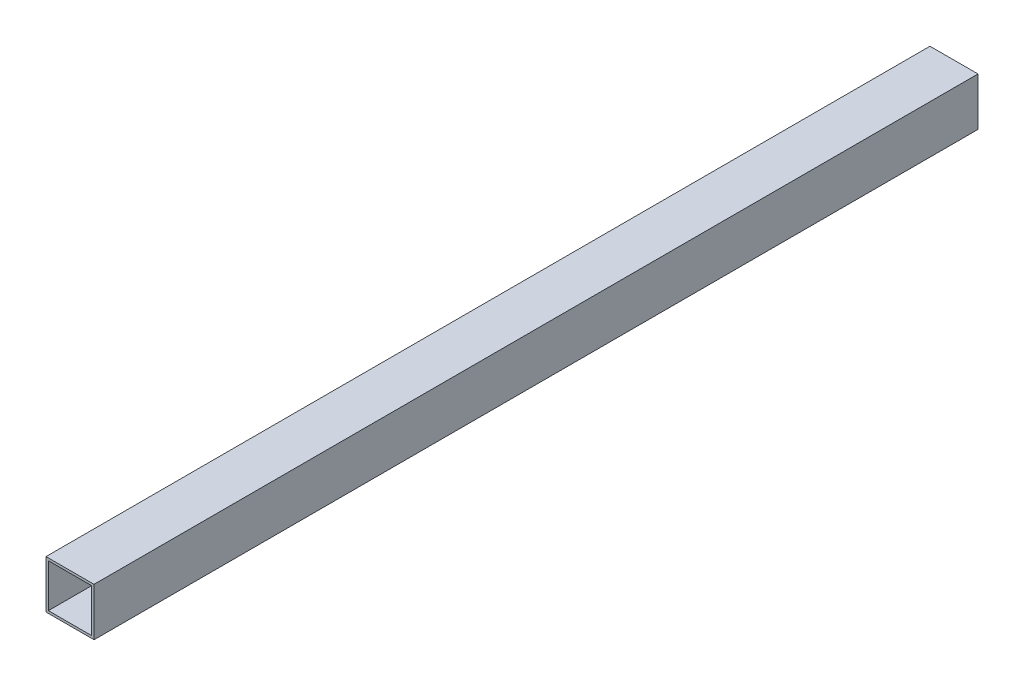
from build123d import *

# Parameters (mm, degrees)
SKETCH1_W           = 100
SKETCH1_H           = 100
SKETCH1_W_2         = 90
SKETCH1_H_2         = 90
BOSS_EXTRUDE1_DEPTH = 920


with BuildPart() as part:
    # Sketch1 → Boss-Extrude1 (new, symmetric)
    with BuildSketch(Plane.XY):
        Rectangle(SKETCH1_W, SKETCH1_H)
        Rectangle(SKETCH1_W_2, SKETCH1_H_2, mode=Mode.SUBTRACT)
    extrude(amount=BOSS_EXTRUDE1_DEPTH, both=True)


solid = part.part
